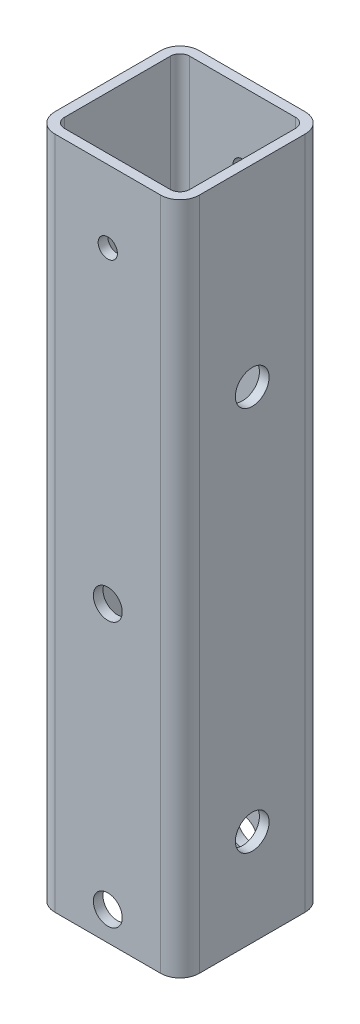
from build123d import *

# Parameters (mm, degrees)
EXTRUDE_1_DEPTH          = 70
SKETCH_3_R               = 3
SKETCH_3_R_2             = 2
CUT_EXTRUDE_1_DEPTH      = 82.853527719
CUT_EXTRUDE_2_DEPTH      = 82.853527719
CUT_EXTRUDE_2_DEPTH_BACK = 82.853527719
SKETCH_4_R               = 3.5


with BuildPart() as part:
    # 草图2 → 凸台-拉伸1 (new, symmetric)
    with BuildSketch(Plane(origin=(0, 0, 0), x_dir=(1, 0, 0), z_dir=(0, 1, 0))):
        with BuildLine():
            Line((4, 0), (26, 0))
            ThreePointArc((26, 0), (28.828427125, 1.171572875), (30, 4))
            Line((30, 4), (30, 26))
            ThreePointArc((30, 26), (28.828427125, 28.828427125), (26, 30))
            Line((26, 30), (4, 30))
            ThreePointArc((4, 30), (1.171572875, 28.828427125), (0, 26))
            Line((0, 26), (0, 4))
            ThreePointArc((0, 4), (1.171572875, 1.171572875), (4, 0))
        make_face()
        with BuildLine():
            Line((4, 2), (26, 2))
            ThreePointArc((26, 2), (27.414213562, 2.585786438), (28, 4))
            Line((28, 4), (28, 26))
            ThreePointArc((28, 26), (27.414213562, 27.414213562), (26, 28))
            Line((26, 28), (4, 28))
            ThreePointArc((4, 28), (2.585786438, 27.414213562), (2, 26))
            Line((2, 26), (2, 4))
            ThreePointArc((2, 4), (2.585786438, 2.585786438), (4, 2))
        make_face(mode=Mode.SUBTRACT)
    extrude(amount=EXTRUDE_1_DEPTH, both=True)

    # 草图3 → 切除-拉伸1 (cut, through all)
    with BuildSketch(Plane.XY):
        with Locations((15, -64)):
            Circle(SKETCH_3_R)
        with Locations((15, -9)):
            Circle(SKETCH_3_R)
        with Locations((15, 55)):
            Circle(SKETCH_3_R_2)
    extrude(amount=-CUT_EXTRUDE_1_DEPTH, mode=Mode.SUBTRACT)

    # 草图4 → 切除-拉伸2 (cut, two sides: drawn at the far end of the back side and taken through both)
    with BuildSketch(Plane(origin=(0, 0, 0), x_dir=(0, 0, -1), z_dir=(1, 0, 0)).offset(-CUT_EXTRUDE_2_DEPTH_BACK)):
        with Locations(Location((15, -50, 0), (0, 0, 180))):
            Circle(SKETCH_4_R)
        with Locations(Location((15, 30, 0), (0, 0, 180))):
            Circle(SKETCH_4_R)
    extrude(amount=CUT_EXTRUDE_2_DEPTH + CUT_EXTRUDE_2_DEPTH_BACK, mode=Mode.SUBTRACT)


solid = part.part
